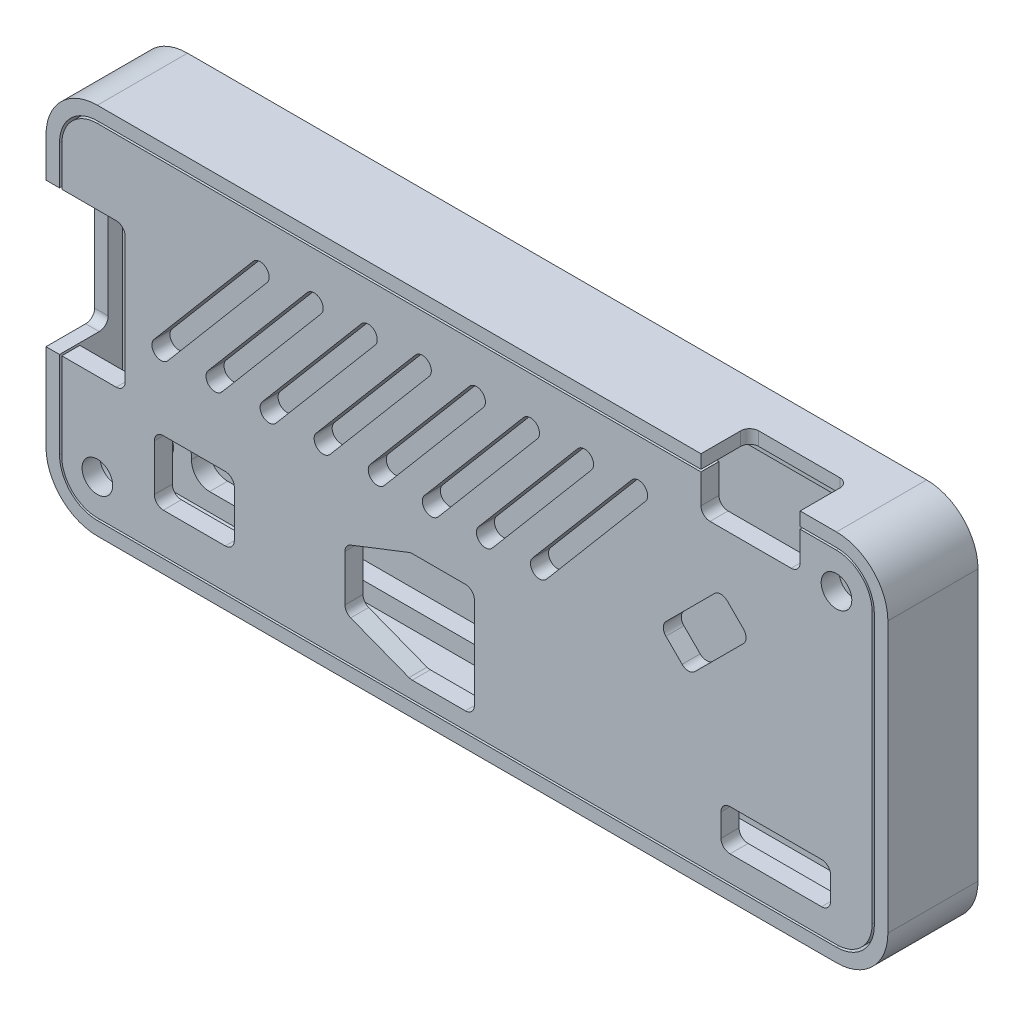
from build123d import *

# Parameters (mm, degrees)
BOSS_EXTRUDE1_DEPTH   = 3
BOSS_EXTRUDE2_START   = 7
BOSS_EXTRUDE2_DEPTH   = 7
M3X0_5_TAPPED_HOLE1_D = 2.9
CUT_EXTRUDE1_DEPTH    = 2
FILLET1_R             = 2
BOSS_EXTRUDE3_DEPTH   = 2
SKETCH6_W             = 8.782
SKETCH6_H             = 16
SKETCH6_W_2           = 8.874
SKETCH6_H_2           = 7.1596
SKETCH6_W_3           = 11
SKETCH6_H_3           = 6
SKETCH6_W_4           = 12.16
SKETCH6_H_4           = 4.54
CUT_EXTRUDE2_DEPTH    = 5.4
FILLET2_R             = 1
CUT_EXTRUDE3_DEPTH    = 2
SKETCH8_R             = 1.7
CUT_EXTRUDE4_DEPTH    = 101.424001115
FILLET3_R             = 1


with BuildPart() as part:
    # Sketch1 → Boss-Extrude1 (new body)
    with BuildSketch(Plane.XY):
        with BuildLine():
            Line((4, 39.7), (86, 39.7))
            ThreePointArc((86, 39.7), (90.030508653, 38.030508653), (91.7, 34))
            Line((91.7, 34), (91.7, 4))
            ThreePointArc((91.7, 4), (90.030508653, -0.030508653), (86, -1.7))
            Line((86, -1.7), (4, -1.7))
            ThreePointArc((4, -1.7), (-0.030508653, -0.030508653), (-1.7, 4))
            Line((-1.7, 4), (-1.7, 34))
            ThreePointArc((-1.7, 34), (-0.030508653, 38.030508653), (4, 39.7))
        make_face()
    extrude(amount=-BOSS_EXTRUDE1_DEPTH)

    # Sketch1<3> → Boss-Extrude2 (add)
    with BuildSketch(Plane.XY.offset(BOSS_EXTRUDE2_START)):
        with BuildLine():
            Line((4, 39.7), (86, 39.7))
            ThreePointArc((86, 39.7), (90.030508653, 38.030508653), (91.7, 34))
            Line((91.7, 34), (91.7, 4))
            ThreePointArc((91.7, 4), (90.030508653, -0.030508653), (86, -1.7))
            Line((86, -1.7), (4, -1.7))
            ThreePointArc((4, -1.7), (-0.030508653, -0.030508653), (-1.7, 4))
            Line((-1.7, 4), (-1.7, 34))
            ThreePointArc((-1.7, 34), (-0.030508653, 38.030508653), (4, 39.7))
        make_face()
        with BuildLine():
            Line((-0.2, 4), (-0.2, 34))
            ThreePointArc((-0.2, 34), (1.030151519, 36.969848481), (4, 38.2))
            Line((4, 38.2), (86, 38.2))
            ThreePointArc((86, 38.2), (88.969848481, 36.969848481), (90.2, 34))
            Line((90.2, 34), (90.2, 4))
            ThreePointArc((90.2, 4), (88.969848481, 1.030151519), (86, -0.2))
            Line((86, -0.2), (4, -0.2))
            ThreePointArc((4, -0.2), (1.030151519, 1.030151519), (-0.2, 4))
        make_face(mode=Mode.SUBTRACT)
    extrude(amount=-BOSS_EXTRUDE2_DEPTH)

    # M3x0.5 Tapped Hole1 (through all)
    with Locations(Plane.XY):
        with Locations((4, 34), (4, 4), (86, 4), (86, 34)):
            Hole(M3X0_5_TAPPED_HOLE1_D / 2)

    # Sketch4 → Cut-Extrude1 (cut)
    with BuildSketch(Plane.XY):
        with BuildLine():
            Line((1.8, 31.342463547), (1.8, 6.657536453))
            ThreePointArc((1.8, 6.657536453), (6.439518395, 6.439518395), (6.657536453, 1.8))
            Line((6.657536453, 1.8), (83.342463547, 1.8))
            ThreePointArc((83.342463547, 1.8), (83.560481605, 6.439518395), (88.2, 6.657536453))
            Line((88.2, 6.657536453), (88.2, 31.342463547))
            ThreePointArc((88.2, 31.342463547), (83.560481605, 31.560481605), (83.342463547, 36.2))
            Line((83.342463547, 36.2), (6.657536453, 36.2))
            ThreePointArc((6.657536453, 36.2), (6.439518395, 31.560481605), (1.8, 31.342463547))
        make_face()
    extrude(amount=-CUT_EXTRUDE1_DEPTH, mode=Mode.SUBTRACT)

    # Fillet1
    fillet1_edges = [part.edges().sort_by_distance(p)[0] for p in [
        (88.2, 6.657536453, -1),
        (83.342463547, 1.8, -1),
        (6.657536453, 1.8, -1),
        (1.8, 6.657536453, -1),
        (1.8, 31.342463547, -1),
        (6.657536453, 36.2, -1),
        (83.342463547, 36.2, -1),
        (88.2, 31.342463547, -1),
    ]]
    fillet(fillet1_edges, radius=FILLET1_R)


with BuildPart() as body_2:
    # Sketch5 → Boss-Extrude3 (new body)
    with BuildSketch(Plane.XY.offset(7)):
        with BuildLine():
            Line((86, 37.95), (4, 37.95))
            ThreePointArc((4, 37.95), (1.206928214, 36.793071786), (0.05, 34))
            Line((0.05, 34), (0.05, 4))
            ThreePointArc((0.05, 4), (1.206928214, 1.206928214), (4, 0.05))
            Line((4, 0.05), (86, 0.05))
            ThreePointArc((86, 0.05), (88.793071786, 1.206928214), (89.95, 4))
            Line((89.95, 4), (89.95, 34))
            ThreePointArc((89.95, 34), (88.793071786, 36.793071786), (86, 37.95))
        make_face()
    extrude(amount=-BOSS_EXTRUDE3_DEPTH)


with BuildPart() as cut_extrude2_tool:
    # Sketch6 → Cut-Extrude2 (new body)
    with BuildSketch(Plane.XY.offset(7)):
        Polygon((38.7456, 14.0852), (31.4652, 11.2392), (31.4652, 4.7392), (38.7456, 1.9252), (45.8256, 1.9252), (45.8256, 14.0852), align=None)
        with Locations((2.691, 21.6504)):
            Rectangle(SKETCH6_W, SKETCH6_H)
        with Locations((14.7534, 8.029)):
            Rectangle(SKETCH6_W_2, SKETCH6_H_2)
        with Locations((76.467, 36.7)):
            Rectangle(SKETCH6_W_3, SKETCH6_H_3)
        Polygon((69.581949, 17.714884213), (66.371684213, 20.925149), (73.174051448, 27.727516235), (76.384316235, 24.517251448), align=None)
        with Locations((79.268, 5.135)):
            Rectangle(SKETCH6_W_4, SKETCH6_H_4)
    extrude(amount=-CUT_EXTRUDE2_DEPTH)


with BuildPart() as part_1:
    add(part.part)

    # Cut-Extrude2: cut by cut_extrude2_tool
    add(cut_extrude2_tool.part, mode=Mode.SUBTRACT)

    # Fillet3
    fillet3_edges = [part_1.edges().sort_by_distance(p)[0] for p in [
        (-0.95, 13.6504, 1.6),
        (-0.95, 29.6504, 1.6),
        (70.967, 38.95, 1.6),
        (81.967, 38.95, 1.6),
    ]]
    fillet(fillet3_edges, radius=FILLET3_R)


with BuildPart() as body_2_1:
    add(body_2.part)

    # Cut-Extrude2: cut by cut_extrude2_tool
    add(cut_extrude2_tool.part, mode=Mode.SUBTRACT)

    # Fillet2
    fillet2_edges = [body_2_1.edges().sort_by_distance(p)[0] for p in [
        (73.188, 7.405, 6),
        (31.4652, 11.2392, 6),
        (31.4652, 4.7392, 6),
        (38.7456, 1.9252, 6),
        (45.8256, 1.9252, 6),
        (45.8256, 14.0852, 6),
        (38.7456, 14.0852, 6),
        (7.082, 29.6504, 6),
        (7.082, 13.6504, 6),
        (10.3164, 4.4492, 6),
        (19.1904, 4.4492, 6),
        (19.1904, 11.6088, 6),
        (10.3164, 11.6088, 6),
        (81.967, 33.7, 6),
        (70.967, 33.7, 6),
        (73.174051448, 27.727516235, 6),
        (66.371684213, 20.925149, 6),
        (69.581949, 17.714884213, 6),
        (76.384316235, 24.517251448, 6),
        (73.188, 2.865, 6),
        (85.348, 2.865, 6),
        (85.348, 7.405, 6),
    ]]
    fillet(fillet2_edges, radius=FILLET2_R)

    # Sketch7 → Cut-Extrude3 (cut)
    with BuildSketch(Plane.XY.offset(7)):
        with BuildLine():
            Line((10.286613715, 20.345942241), (21.286613715, 33.345942241))
            ThreePointArc((21.286613715, 33.345942241), (22.695942241, 33.463386285), (22.813386285, 32.054057759))
            Line((22.813386285, 32.054057759), (11.813386285, 19.054057759))
            ThreePointArc((11.813386285, 19.054057759), (10.404057759, 18.936613715), (10.286613715, 20.345942241))
        make_face()
        with BuildLine():
            Line((16.286613715, 20.345942241), (27.286613715, 33.345942241))
            ThreePointArc((27.286613715, 33.345942241), (28.695942241, 33.463386285), (28.813386285, 32.054057759))
            Line((28.813386285, 32.054057759), (17.813386285, 19.054057759))
            ThreePointArc((17.813386285, 19.054057759), (16.404057759, 18.936613715), (16.286613715, 20.345942241))
        make_face()
        with BuildLine():
            Line((22.286613715, 20.345942241), (33.286613715, 33.345942241))
            ThreePointArc((33.286613715, 33.345942241), (34.695942241, 33.463386285), (34.813386285, 32.054057759))
            Line((34.813386285, 32.054057759), (23.813386285, 19.054057759))
            ThreePointArc((23.813386285, 19.054057759), (22.404057759, 18.936613715), (22.286613715, 20.345942241))
        make_face()
        with BuildLine():
            Line((28.286613715, 20.345942241), (39.286613715, 33.345942241))
            ThreePointArc((39.286613715, 33.345942241), (40.695942241, 33.463386285), (40.813386285, 32.054057759))
            Line((40.813386285, 32.054057759), (29.813386285, 19.054057759))
            ThreePointArc((29.813386285, 19.054057759), (28.404057759, 18.936613715), (28.286613715, 20.345942241))
        make_face()
        with BuildLine():
            Line((34.286613715, 20.345942241), (45.286613715, 33.345942241))
            ThreePointArc((45.286613715, 33.345942241), (46.695942241, 33.463386285), (46.813386285, 32.054057759))
            Line((46.813386285, 32.054057759), (35.813386285, 19.054057759))
            ThreePointArc((35.813386285, 19.054057759), (34.404057759, 18.936613715), (34.286613715, 20.345942241))
        make_face()
        with BuildLine():
            Line((40.286613715, 20.345942241), (51.286613715, 33.345942241))
            ThreePointArc((51.286613715, 33.345942241), (52.695942241, 33.463386285), (52.813386285, 32.054057759))
            Line((52.813386285, 32.054057759), (41.813386285, 19.054057759))
            ThreePointArc((41.813386285, 19.054057759), (40.404057759, 18.936613715), (40.286613715, 20.345942241))
        make_face()
        with BuildLine():
            Line((46.286613715, 20.345942241), (57.286613715, 33.345942241))
            ThreePointArc((57.286613715, 33.345942241), (58.695942241, 33.463386285), (58.813386285, 32.054057759))
            Line((58.813386285, 32.054057759), (47.813386285, 19.054057759))
            ThreePointArc((47.813386285, 19.054057759), (46.404057759, 18.936613715), (46.286613715, 20.345942241))
        make_face()
        with BuildLine():
            Line((52.286613715, 20.345942241), (63.286613715, 33.345942241))
            ThreePointArc((63.286613715, 33.345942241), (64.695942241, 33.463386285), (64.813386285, 32.054057759))
            Line((64.813386285, 32.054057759), (53.813386285, 19.054057759))
            ThreePointArc((53.813386285, 19.054057759), (52.404057759, 18.936613715), (52.286613715, 20.345942241))
        make_face()
    extrude(amount=-CUT_EXTRUDE3_DEPTH, mode=Mode.SUBTRACT)

    # Sketch8 → Cut-Extrude4 (cut, through all)
    with BuildSketch(Plane.XY.offset(7)):
        with Locations((4, 4)):
            Circle(SKETCH8_R)
        with Locations((86, 34)):
            Circle(SKETCH8_R)
    extrude(amount=-CUT_EXTRUDE4_DEPTH, mode=Mode.SUBTRACT)


solid = Compound([part_1.part, body_2_1.part])
